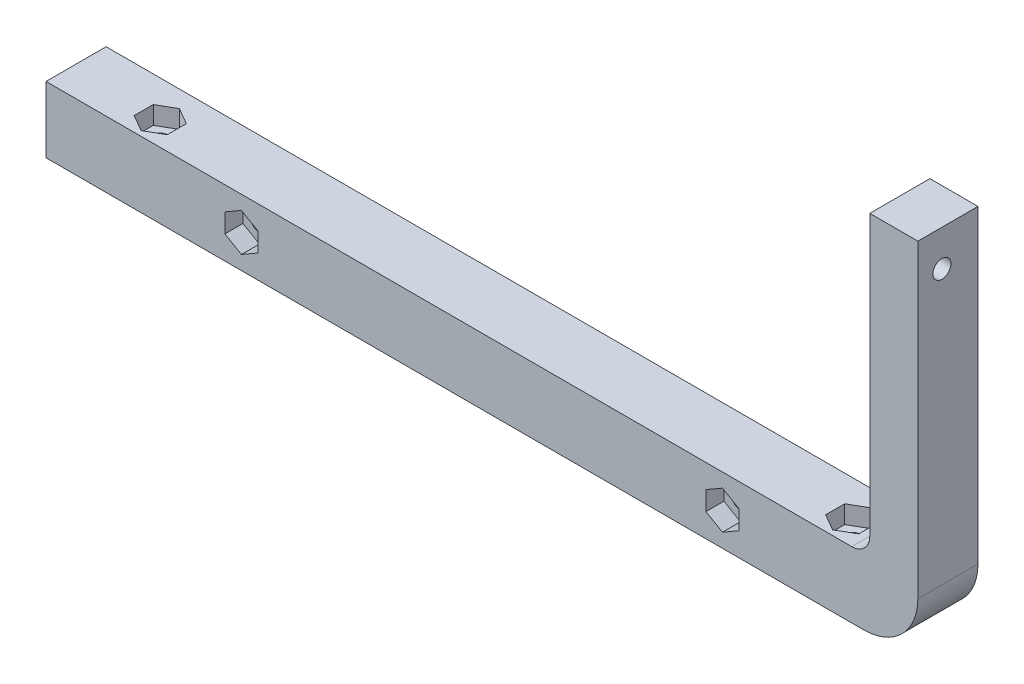
from build123d import *

# Parameters (mm, degrees)
ESQUISSE1_W             = 145
ESQUISSE1_H             = 10
BOSS_EXTRU_1_DEPTH      = 11
ESQUISSE2_R             = 1.5
ENL_V_MAT_EXTRU_1_DEPTH = 75.008445464
ESQUISSE3_R             = 1.5
ENL_V_MAT_EXTRU_2_DEPTH = 75.008445464
ENL_V_MAT_EXTRU_3_DEPTH = 3
ENL_V_MAT_EXTRU_4_DEPTH = 3
CONG_1_R                = 9
ESQUISSE6_W             = 8
ESQUISSE6_H             = 10
BOSS_EXTRU_2_DEPTH      = 49.5
CONG_2_R                = 3
ESQUISSE7_R             = 1.5
ENL_V_MAT_EXTRU_5_DEPTH = 158.433319218
ENL_V_MAT_EXTRU_6_DEPTH = 3
BOSS_EXTRU_3_START      = -0.2
BOSS_EXTRU_3_DEPTH      = 0.2


with BuildPart() as part:
    # Esquisse1 → Boss.-Extru.1 (new body)
    with BuildSketch(Plane(origin=(0, 0, 0), x_dir=(1, 0, 0), z_dir=(0, 1, 0))):
        with Locations((0, 5)):
            Rectangle(ESQUISSE1_W, ESQUISSE1_H)
    extrude(amount=BOSS_EXTRU_1_DEPTH)

    # Esquisse2 → Enlèv. mat.-Extru.1 (cut, through all)
    with BuildSketch(Plane(origin=(0, 11, 0), x_dir=(1, 0, 0), z_dir=(0, 1, 0))):
        with Locations(Location((-57.5, 4, 0), (0, 0, 270))):
            Circle(ESQUISSE2_R)
        with Locations(Location((57.5, 4, 0), (0, 0, 270))):
            Circle(ESQUISSE2_R)
    extrude(amount=-ENL_V_MAT_EXTRU_1_DEPTH, mode=Mode.SUBTRACT)

    # Esquisse3 → Enlèv. mat.-Extru.2 (cut, through all)
    with BuildSketch(Plane.XY):
        with Locations((-40, 5.5)):
            Circle(ESQUISSE3_R)
        with Locations(Location((40, 5.5, 0), (0, 0, 180))):
            Circle(ESQUISSE3_R)
    extrude(amount=-ENL_V_MAT_EXTRU_2_DEPTH, mode=Mode.SUBTRACT)

    # Esquisse4 → Enlèv. mat.-Extru.3 (cut)
    with BuildSketch(Plane.XY):
        Polygon((-37.25, 7.08771324), (-40, 8.675426481), (-42.75, 7.08771324), (-42.75, 3.91228676), (-40, 2.324573519), (-37.25, 3.91228676), align=None)
        Polygon((42.75, 7.08771324), (40, 8.675426481), (37.25, 7.08771324), (37.25, 3.91228676), (40, 2.324573519), (42.75, 3.91228676), align=None)
    extrude(amount=-ENL_V_MAT_EXTRU_3_DEPTH, mode=Mode.SUBTRACT)

    # Esquisse5 → Enlèv. mat.-Extru.4 (cut)
    with BuildSketch(Plane(origin=(0, 11, 0), x_dir=(1, 0, 0), z_dir=(0, 1, 0))):
        Polygon((-54.75, 5.58771324), (-57.5, 7.175426481), (-60.25, 5.58771324), (-60.25, 2.41228676), (-57.5, 0.824573519), (-54.75, 2.41228676), align=None)
        Polygon((60.25, 5.58771324), (57.5, 7.175426481), (54.75, 5.58771324), (54.75, 2.41228676), (57.5, 0.824573519), (60.25, 2.41228676), align=None)
    extrude(amount=-ENL_V_MAT_EXTRU_4_DEPTH, mode=Mode.SUBTRACT)

    # Congé1
    cong_1_edges = [part.edges().sort_by_distance(p)[0] for p in [
        (72.5, 0, -5),
    ]]
    fillet(cong_1_edges, radius=CONG_1_R)

    # Esquisse6 → Boss.-Extru.2 (add)
    with BuildSketch(Plane(origin=(0, 11, 0), x_dir=(1, 0, 0), z_dir=(0, 1, 0))):
        with Locations((68.5, 5)):
            Rectangle(ESQUISSE6_W, ESQUISSE6_H)
    extrude(amount=BOSS_EXTRU_2_DEPTH)

    # Congé2
    cong_2_edges = [part.edges().sort_by_distance(p)[0] for p in [
        (64.5, 11, -5),
    ]]
    fillet(cong_2_edges, radius=CONG_2_R)

    # Esquisse7 → Enlèv. mat.-Extru.5 (cut, through all)
    with BuildSketch(Plane(origin=(72.5, 0, 0), x_dir=(0, 0, -1), z_dir=(1, 0, 0))):
        with Locations((4, 54.5)):
            Circle(ESQUISSE7_R)
    extrude(amount=-ENL_V_MAT_EXTRU_5_DEPTH, mode=Mode.SUBTRACT)

    # Esquisse8 → Enlèv. mat.-Extru.6 (cut)
    with BuildSketch(Plane.ZY.offset(-64.5)):
        Polygon((-0.824573519, 54.5), (-2.41228676, 57.25), (-5.58771324, 57.25), (-7.175426481, 54.5), (-5.58771324, 51.75), (-2.41228676, 51.75), align=None)
    extrude(amount=-ENL_V_MAT_EXTRU_6_DEPTH, mode=Mode.SUBTRACT)

    # Esquisse9 → Boss.-Extru.3 (add)
    with BuildSketch(Plane(origin=(0, 0, -10), x_dir=(-1, 0, 0), z_dir=(0, 0, -1)).offset(BOSS_EXTRU_3_START)):
        with BuildLine():
            Line((-72.5, 60.5), (-72.5, 9))
            ThreePointArc((-72.5, 9), (-69.863961031, 2.636038969), (-63.5, 0))
            Line((-63.5, 0), (72.5, 0))
            Line((72.5, 0), (72.5, 11))
            Line((72.5, 11), (-61.5, 11))
            ThreePointArc((-61.5, 11), (-63.621320344, 11.878679656), (-64.5, 14))
            Line((-64.5, 14), (-64.5, 60.5))
            Line((-64.5, 60.5), (-72.5, 60.5))
        make_face()
    extrude(amount=BOSS_EXTRU_3_DEPTH)


solid = part.part
